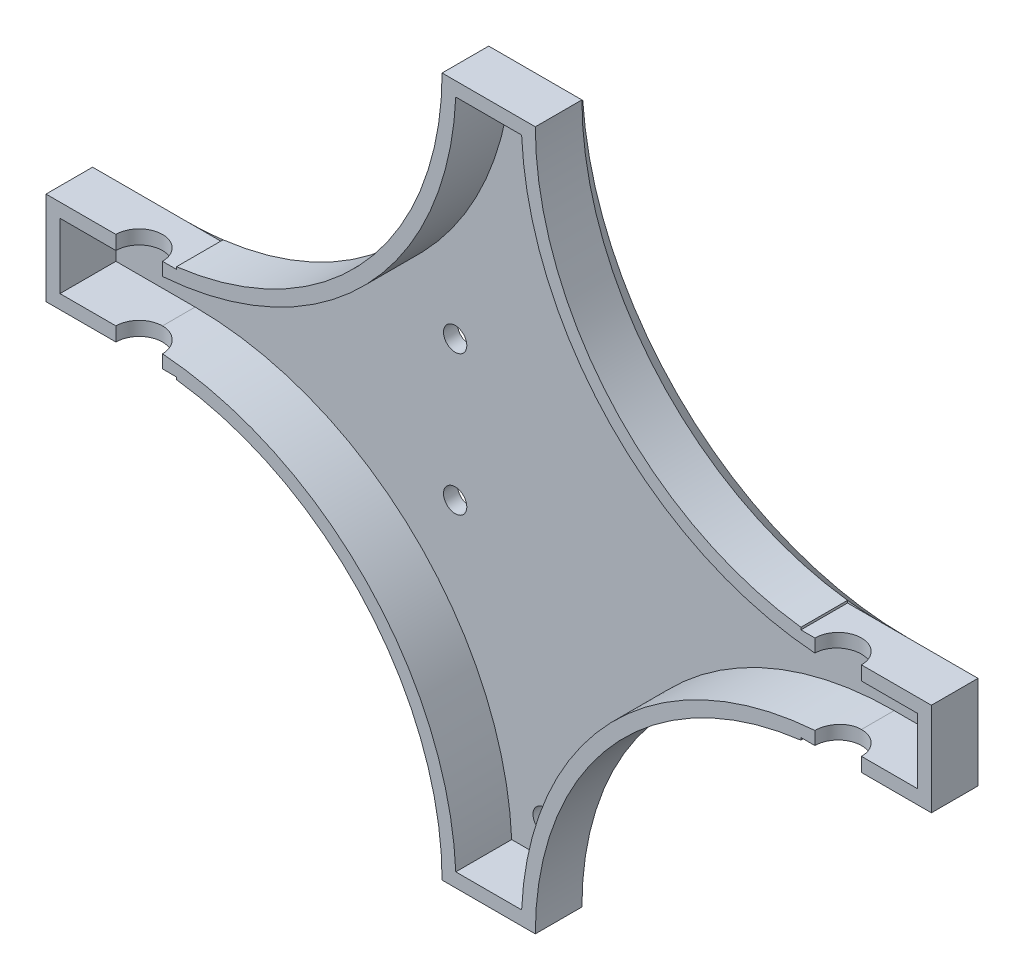
from build123d import *
from build123d.topology import SkipClean

# Parameters (mm, degrees)
SKETCH1_W               = 200
SKETCH1_H               = 150
BOSS_EXTRUDE1_DEPTH     = 15
CUT_EXTRUDE2_DEPTH      = 30
SHELL2_T                = -3
SKETCH6_R               = 2.5
CUT_EXTRUDE3_DEPTH      = 30
CUT_EXTRUDE4_DEPTH      = 30
CUT_EXTRUDE4_DEPTH_BACK = 30
SKETCH7_R               = 5
CHAMFER1_SIZE           = 5
SKETCH8_R               = 2.5
CUT_EXTRUDE5_DEPTH      = 10
SKETCH9_W               = 105
SKETCH9_H               = 150
CUT_EXTRUDE8_DEPTH      = 50
SKETCH10_R              = 2.5
CUT_EXTRUDE9_DEPTH      = 50
SKETCH11_W              = 10
SKETCH11_H              = 2.828590786
CUT_EXTRUDE10_DEPTH     = 28
SKETCH12_W              = 10
SKETCH12_H              = 3.286754743
SKETCH12_H_2            = 3.432076944
CUT_EXTRUDE11_DEPTH     = 28


with BuildPart() as part:
    # Sketch1 → Boss-Extrude1 (new body)
    with BuildSketch(Plane.XY):
        Rectangle(SKETCH1_W, SKETCH1_H)
    extrude(amount=BOSS_EXTRUDE1_DEPTH)

    # Sketch5 → Cut-Extrude2 (cut)
    with BuildSketch(Plane(origin=(0, 0, 0), x_dir=(-1, 0, 0), z_dir=(0, 0, -1))):
        with BuildLine():
            Line((100, 75), (5, 75))
            ThreePointArc((5, 75), (24.038059223, 29.038059223), (70, 10))
            Line((70, 10), (100, 10))
            Line((100, 10), (100, 75))
        make_face()
        with BuildLine():
            ThreePointArc((70, -10), (24.038059223, -29.038059223), (5, -75))
            Line((5, -75), (100, -75))
            Line((100, -75), (100, -10))
            Line((100, -10), (70, -10))
        make_face()
        with BuildLine():
            Line((-80, -10), (-100, -10))
            Line((-100, -10), (-100, -75))
            Line((-100, -75), (-15, -75))
            ThreePointArc((-15, -75), (-34.038059223, -29.038059223), (-80, -10))
        make_face()
        with BuildLine():
            Line((-100, 75), (-100, 10))
            Line((-100, 10), (-80, 10))
            ThreePointArc((-80, 10), (-34.038059223, 29.038059223), (-15, 75))
            Line((-15, 75), (-100, 75))
        make_face()
    extrude(amount=-CUT_EXTRUDE2_DEPTH, mode=Mode.SUBTRACT)

    # Shell2
    shell2_openings = [part.faces().sort_by_distance(p)[0] for p in [
        (3.044348512, 0, 15),
    ]]
    offset(amount=SHELL2_T, openings=shell2_openings, kind=Kind.INTERSECTION)

    # Sketch6 → Cut-Extrude3 (cut)
    with BuildSketch(Plane(origin=(0, 0, 0), x_dir=(-1, 0, 0), z_dir=(0, 0, -1))):
        with Locations((-5, 65)):
            Circle(SKETCH6_R)
        with Locations((-5, -65)):
            Circle(SKETCH6_R)
    extrude(amount=-CUT_EXTRUDE3_DEPTH, mode=Mode.SUBTRACT)

    # Sketch7 → Cut-Extrude4 (cut, two sides: drawn at the far end of the back side and taken through both)
    with BuildSketch(Plane(origin=(0, 0, 0), x_dir=(1, 0, 0), z_dir=(0, 1, 0)).offset(-CUT_EXTRUDE4_DEPTH_BACK)):
        with Locations((-80, -15)):
            Circle(SKETCH7_R)
        with Locations((80, -15)):
            Circle(SKETCH7_R)
    extrude(amount=CUT_EXTRUDE4_DEPTH + CUT_EXTRUDE4_DEPTH_BACK, mode=Mode.SUBTRACT)

    # Chamfer1
    chamfer1_edges = [part.edges().sort_by_distance(p)[0] for p in [
        (-100, 0, 0),
        (5, 75, 0),
        (100, 0, 0),
        (5, -75, 0),
        (90, 10, 0),
        (34.038059223, 29.038059223, 0),
        (34.038059223, -29.038059223, 0),
        (90, -10, 0),
        (-24.038059223, -29.038059223, 0),
        (-85, -10, 0),
        (-24.038059223, 29.038059223, 0),
        (-85, 10, 0),
    ]]
    chamfer(chamfer1_edges, length=CHAMFER1_SIZE)

    # Sketch8 → Cut-Extrude5 (cut)
    with BuildSketch(Plane.XY.offset(3)):
        with Locations((-22, 15)):
            Circle(SKETCH8_R)
        with Locations((-22, -15)):
            Circle(SKETCH8_R)
    extrude(amount=-CUT_EXTRUDE5_DEPTH, mode=Mode.SUBTRACT)

    # Sketch9 → Cut-Extrude8 (cut)
    with BuildSketch(Plane.XY):
        with Locations((-47.5, 0)):
            Rectangle(SKETCH9_W, SKETCH9_H)
    extrude(amount=CUT_EXTRUDE8_DEPTH, mode=Mode.SUBTRACT)

    # Mirror4: part across plane


with BuildPart() as part_1:
    with SkipClean():  # the faces are left unmerged after this step: merging them gives an invalid solid
        add(part.part)
        add(part.part.mirror(Plane(origin=(5, 75, 50), x_dir=(0, 0, 1), z_dir=(-1, 0, 0))))

    # Sketch10 → Cut-Extrude9 (cut)
    with SkipClean():  # the faces are left unmerged after this step: merging them gives an invalid solid
        with BuildSketch(Plane.XY):
            with Locations((-14.2, 15)):
                Circle(SKETCH10_R)
            with Locations((-14.2, -15)):
                Circle(SKETCH10_R)
        extrude(amount=CUT_EXTRUDE9_DEPTH, mode=Mode.SUBTRACT)

    # Sketch11 → Cut-Extrude10 (cut)
    with SkipClean():  # the faces are left unmerged after this step: merging them gives an invalid solid
        with BuildSketch(Plane.ZY.offset(90)):
            with Locations((10, 11.414295393)):
                Rectangle(SKETCH11_W, SKETCH11_H)
            with Locations((10, -11.414295393)):
                Rectangle(SKETCH11_W, SKETCH11_H)
        extrude(amount=-CUT_EXTRUDE10_DEPTH, mode=Mode.SUBTRACT)

    # Sketch12 → Cut-Extrude11 (cut)
    with SkipClean():  # the faces are left unmerged after this step: merging them gives an invalid solid
        with BuildSketch(Plane(origin=(100, 0, 0), x_dir=(0, 0, -1), z_dir=(1, 0, 0))):
            with Locations((-10, -11.643377372)):
                Rectangle(SKETCH12_W, SKETCH12_H)
            with Locations((-10, 11.716038472)):
                Rectangle(SKETCH12_W, SKETCH12_H_2)
        extrude(amount=-CUT_EXTRUDE11_DEPTH, mode=Mode.SUBTRACT)


solid = part_1.part
